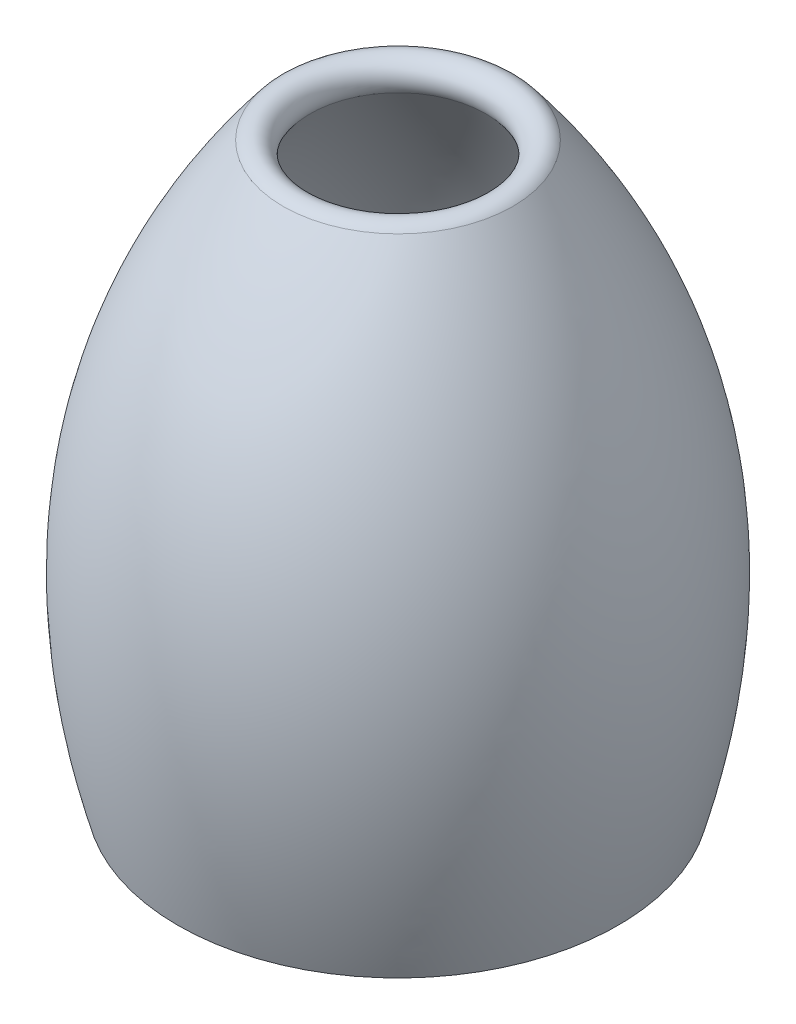
from build123d import *


with BuildPart() as part:
    # Sketch2 → Revolve5 (revolve)
    with BuildSketch(Plane.XY, mode=Mode.PRIVATE) as revolve5_sk:
        with BuildLine():
            Line((0, 0), (4.814136067, 1.350590215))
            add(Edge.make_bspline(
                [(4.814136067, 1.350590215), (0.092820682, 18.262630863), (1.564765771, 43.576073139), (9.136778367, 67.246654091), (19.322611282, 80.230027244)],
                knots=[0, 0, 0, 0.375, 0.625, 1, 1, 1], degree=2))
            ThreePointArc((19.322611282, 80.230027244), (18.729056793, 83.519915496), (15.392012511, 83.320398306))
            add(Edge.make_bspline(
                [(0, 0), (-13.180076775, 46.979966437), (15.392012511, 83.320398306)],
                knots=[0, 0, 0, 1, 1, 1], degree=2))
        make_face()
    revolve(revolve5_sk.sketch.rotate(Axis((32.183298888, 1.350590215, 0), (0, 1, 0)), 270), axis=Axis((32.183298888, 1.350590215, 0), (0, 1, 0)))


solid = part.part
